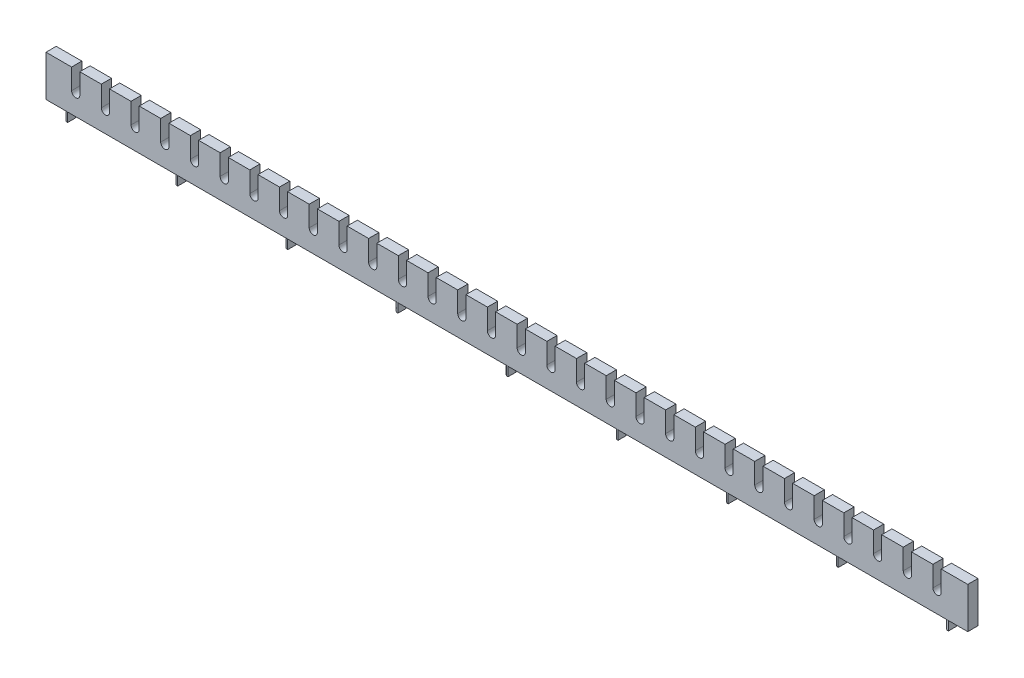
from build123d import *

# Parameters (mm, degrees)
SKETCH1_W           = 571.5
SKETCH1_H           = 6.35
BOSS_EXTRUDE1_DEPTH = 25.4
BOSS_EXTRUDE2_DEPTH = 6.35
CUT_EXTRUDE1_DEPTH  = 287.946937603


with BuildPart() as part:
    # Sketch1 → Boss-Extrude1 (new body)
    with BuildSketch(Plane(origin=(0, 0, 0), x_dir=(1, 0, 0), z_dir=(0, 1, 0))):
        Rectangle(SKETCH1_W, SKETCH1_H)
    extrude(amount=BOSS_EXTRUDE1_DEPTH)

    # Sketch2 → Boss-Extrude2 (add)
    with BuildSketch(Plane.XZ):
        with BuildLine():
            Line((-273.05, 2.54), (-273.05, -2.54))
            ThreePointArc((-273.05, -2.54), (-275.59, 0), (-273.05, 2.54))
        make_face()
        with BuildLine():
            Line((-204.7875, 2.54), (-204.7875, -2.54))
            ThreePointArc((-204.7875, -2.54), (-207.3275, 0), (-204.7875, 2.54))
        make_face()
        with BuildLine():
            Line((-136.525, 2.54), (-136.525, -2.54))
            ThreePointArc((-136.525, -2.54), (-139.065, 0), (-136.525, 2.54))
        make_face()
        with BuildLine():
            Line((-68.2625, 2.54), (-68.2625, -2.54))
            ThreePointArc((-68.2625, -2.54), (-70.8025, 0), (-68.2625, 2.54))
        make_face()
        with BuildLine():
            Line((0, 2.54), (0, -2.54))
            ThreePointArc((0, -2.54), (-2.54, 0), (0, 2.54))
        make_face()
        with BuildLine():
            Line((68.2625, 2.54), (68.2625, -2.54))
            ThreePointArc((68.2625, -2.54), (65.7225, 0), (68.2625, 2.54))
        make_face()
        with BuildLine():
            Line((136.525, 2.54), (136.525, -2.54))
            ThreePointArc((136.525, -2.54), (133.985, 0), (136.525, 2.54))
        make_face()
        with BuildLine():
            Line((204.7875, 2.54), (204.7875, -2.54))
            ThreePointArc((204.7875, -2.54), (202.2475, 0), (204.7875, 2.54))
        make_face()
        with BuildLine():
            Line((273.05, 2.54), (273.05, -2.54))
            ThreePointArc((273.05, -2.54), (270.51, 0), (273.05, 2.54))
        make_face()
    extrude(amount=BOSS_EXTRUDE2_DEPTH)

    # Sketch3 → Cut-Extrude1 (cut, through all)
    with BuildSketch(Plane.XY.offset(3.175)):
        with BuildLine():
            Line((-264.795, 38.1), (-264.795, 12.7))
            ThreePointArc((-264.795, 12.7), (-267.335, 10.16), (-269.875, 12.7))
            Line((-269.875, 12.7), (-269.875, 38.1))
            ThreePointArc((-269.875, 38.1), (-267.335, 40.64), (-264.795, 38.1))
        make_face()
        with BuildLine():
            Line((-246.38, 38.1), (-246.38, 12.7))
            ThreePointArc((-246.38, 12.7), (-248.92, 10.16), (-251.46, 12.7))
            Line((-251.46, 12.7), (-251.46, 38.1))
            ThreePointArc((-251.46, 38.1), (-248.92, 40.64), (-246.38, 38.1))
        make_face()
        with BuildLine():
            Line((-227.965, 38.1), (-227.965, 12.7))
            ThreePointArc((-227.965, 12.7), (-230.505, 10.16), (-233.045, 12.7))
            Line((-233.045, 12.7), (-233.045, 38.1))
            ThreePointArc((-233.045, 38.1), (-230.505, 40.64), (-227.965, 38.1))
        make_face()
        with BuildLine():
            Line((-209.55, 38.1), (-209.55, 12.7))
            ThreePointArc((-209.55, 12.7), (-212.09, 10.16), (-214.63, 12.7))
            Line((-214.63, 12.7), (-214.63, 38.1))
            ThreePointArc((-214.63, 38.1), (-212.09, 40.64), (-209.55, 38.1))
        make_face()
        with BuildLine():
            Line((-191.135, 38.1), (-191.135, 12.7))
            ThreePointArc((-191.135, 12.7), (-193.675, 10.16), (-196.215, 12.7))
            Line((-196.215, 12.7), (-196.215, 38.1))
            ThreePointArc((-196.215, 38.1), (-193.675, 40.64), (-191.135, 38.1))
        make_face()
        with BuildLine():
            Line((-172.72, 38.1), (-172.72, 12.7))
            ThreePointArc((-172.72, 12.7), (-175.26, 10.16), (-177.8, 12.7))
            Line((-177.8, 12.7), (-177.8, 38.1))
            ThreePointArc((-177.8, 38.1), (-175.26, 40.64), (-172.72, 38.1))
        make_face()
        with BuildLine():
            Line((-154.305, 38.1), (-154.305, 12.7))
            ThreePointArc((-154.305, 12.7), (-156.845, 10.16), (-159.385, 12.7))
            Line((-159.385, 12.7), (-159.385, 38.1))
            ThreePointArc((-159.385, 38.1), (-156.845, 40.64), (-154.305, 38.1))
        make_face()
        with BuildLine():
            Line((-135.89, 38.1), (-135.89, 12.7))
            ThreePointArc((-135.89, 12.7), (-138.43, 10.16), (-140.97, 12.7))
            Line((-140.97, 12.7), (-140.97, 38.1))
            ThreePointArc((-140.97, 38.1), (-138.43, 40.64), (-135.89, 38.1))
        make_face()
        with BuildLine():
            Line((-117.475, 38.1), (-117.475, 12.7))
            ThreePointArc((-117.475, 12.7), (-120.015, 10.16), (-122.555, 12.7))
            Line((-122.555, 12.7), (-122.555, 38.1))
            ThreePointArc((-122.555, 38.1), (-120.015, 40.64), (-117.475, 38.1))
        make_face()
        with BuildLine():
            Line((-99.06, 38.1), (-99.06, 12.7))
            ThreePointArc((-99.06, 12.7), (-101.6, 10.16), (-104.14, 12.7))
            Line((-104.14, 12.7), (-104.14, 38.1))
            ThreePointArc((-104.14, 38.1), (-101.6, 40.64), (-99.06, 38.1))
        make_face()
        with BuildLine():
            Line((-80.645, 38.1), (-80.645, 12.7))
            ThreePointArc((-80.645, 12.7), (-83.185, 10.16), (-85.725, 12.7))
            Line((-85.725, 12.7), (-85.725, 38.1))
            ThreePointArc((-85.725, 38.1), (-83.185, 40.64), (-80.645, 38.1))
        make_face()
        with BuildLine():
            Line((-62.23, 38.1), (-62.23, 12.7))
            ThreePointArc((-62.23, 12.7), (-64.77, 10.16), (-67.31, 12.7))
            Line((-67.31, 12.7), (-67.31, 38.1))
            ThreePointArc((-67.31, 38.1), (-64.77, 40.64), (-62.23, 38.1))
        make_face()
        with BuildLine():
            Line((-43.815, 38.1), (-43.815, 12.7))
            ThreePointArc((-43.815, 12.7), (-46.355, 10.16), (-48.895, 12.7))
            Line((-48.895, 12.7), (-48.895, 38.1))
            ThreePointArc((-48.895, 38.1), (-46.355, 40.64), (-43.815, 38.1))
        make_face()
        with BuildLine():
            Line((-25.4, 38.1), (-25.4, 12.7))
            ThreePointArc((-25.4, 12.7), (-27.94, 10.16), (-30.48, 12.7))
            Line((-30.48, 12.7), (-30.48, 38.1))
            ThreePointArc((-30.48, 38.1), (-27.94, 40.64), (-25.4, 38.1))
        make_face()
        with BuildLine():
            Line((-6.985, 38.1), (-6.985, 12.7))
            ThreePointArc((-6.985, 12.7), (-9.525, 10.16), (-12.065, 12.7))
            Line((-12.065, 12.7), (-12.065, 38.1))
            ThreePointArc((-12.065, 38.1), (-9.525, 40.64), (-6.985, 38.1))
        make_face()
        with BuildLine():
            Line((11.43, 38.1), (11.43, 12.7))
            ThreePointArc((11.43, 12.7), (8.89, 10.16), (6.35, 12.7))
            Line((6.35, 12.7), (6.35, 38.1))
            ThreePointArc((6.35, 38.1), (8.89, 40.64), (11.43, 38.1))
        make_face()
        with BuildLine():
            Line((29.845, 38.1), (29.845, 12.7))
            ThreePointArc((29.845, 12.7), (27.305, 10.16), (24.765, 12.7))
            Line((24.765, 12.7), (24.765, 38.1))
            ThreePointArc((24.765, 38.1), (27.305, 40.64), (29.845, 38.1))
        make_face()
        with BuildLine():
            Line((48.26, 38.1), (48.26, 12.7))
            ThreePointArc((48.26, 12.7), (45.72, 10.16), (43.18, 12.7))
            Line((43.18, 12.7), (43.18, 38.1))
            ThreePointArc((43.18, 38.1), (45.72, 40.64), (48.26, 38.1))
        make_face()
        with BuildLine():
            Line((66.675, 38.1), (66.675, 12.7))
            ThreePointArc((66.675, 12.7), (64.135, 10.16), (61.595, 12.7))
            Line((61.595, 12.7), (61.595, 38.1))
            ThreePointArc((61.595, 38.1), (64.135, 40.64), (66.675, 38.1))
        make_face()
        with BuildLine():
            Line((85.09, 38.1), (85.09, 12.7))
            ThreePointArc((85.09, 12.7), (82.55, 10.16), (80.01, 12.7))
            Line((80.01, 12.7), (80.01, 38.1))
            ThreePointArc((80.01, 38.1), (82.55, 40.64), (85.09, 38.1))
        make_face()
        with BuildLine():
            Line((103.505, 38.1), (103.505, 12.7))
            ThreePointArc((103.505, 12.7), (100.965, 10.16), (98.425, 12.7))
            Line((98.425, 12.7), (98.425, 38.1))
            ThreePointArc((98.425, 38.1), (100.965, 40.64), (103.505, 38.1))
        make_face()
        with BuildLine():
            Line((121.92, 38.1), (121.92, 12.7))
            ThreePointArc((121.92, 12.7), (119.38, 10.16), (116.84, 12.7))
            Line((116.84, 12.7), (116.84, 38.1))
            ThreePointArc((116.84, 38.1), (119.38, 40.64), (121.92, 38.1))
        make_face()
        with BuildLine():
            Line((140.335, 38.1), (140.335, 12.7))
            ThreePointArc((140.335, 12.7), (137.795, 10.16), (135.255, 12.7))
            Line((135.255, 12.7), (135.255, 38.1))
            ThreePointArc((135.255, 38.1), (137.795, 40.64), (140.335, 38.1))
        make_face()
        with BuildLine():
            Line((158.75, 38.1), (158.75, 12.7))
            ThreePointArc((158.75, 12.7), (156.21, 10.16), (153.67, 12.7))
            Line((153.67, 12.7), (153.67, 38.1))
            ThreePointArc((153.67, 38.1), (156.21, 40.64), (158.75, 38.1))
        make_face()
        with BuildLine():
            Line((177.165, 38.1), (177.165, 12.7))
            ThreePointArc((177.165, 12.7), (174.625, 10.16), (172.085, 12.7))
            Line((172.085, 12.7), (172.085, 38.1))
            ThreePointArc((172.085, 38.1), (174.625, 40.64), (177.165, 38.1))
        make_face()
        with BuildLine():
            Line((195.58, 38.1), (195.58, 12.7))
            ThreePointArc((195.58, 12.7), (193.04, 10.16), (190.5, 12.7))
            Line((190.5, 12.7), (190.5, 38.1))
            ThreePointArc((190.5, 38.1), (193.04, 40.64), (195.58, 38.1))
        make_face()
        with BuildLine():
            Line((213.995, 38.1), (213.995, 12.7))
            ThreePointArc((213.995, 12.7), (211.455, 10.16), (208.915, 12.7))
            Line((208.915, 12.7), (208.915, 38.1))
            ThreePointArc((208.915, 38.1), (211.455, 40.64), (213.995, 38.1))
        make_face()
        with BuildLine():
            Line((232.41, 38.1), (232.41, 12.7))
            ThreePointArc((232.41, 12.7), (229.87, 10.16), (227.33, 12.7))
            Line((227.33, 12.7), (227.33, 38.1))
            ThreePointArc((227.33, 38.1), (229.87, 40.64), (232.41, 38.1))
        make_face()
        with BuildLine():
            Line((250.825, 38.1), (250.825, 12.7))
            ThreePointArc((250.825, 12.7), (248.285, 10.16), (245.745, 12.7))
            Line((245.745, 12.7), (245.745, 38.1))
            ThreePointArc((245.745, 38.1), (248.285, 40.64), (250.825, 38.1))
        make_face()
        with BuildLine():
            Line((269.24, 38.1), (269.24, 12.7))
            ThreePointArc((269.24, 12.7), (266.7, 10.16), (264.16, 12.7))
            Line((264.16, 12.7), (264.16, 38.1))
            ThreePointArc((264.16, 38.1), (266.7, 40.64), (269.24, 38.1))
        make_face()
    extrude(amount=-CUT_EXTRUDE1_DEPTH, mode=Mode.SUBTRACT)


solid = part.part
